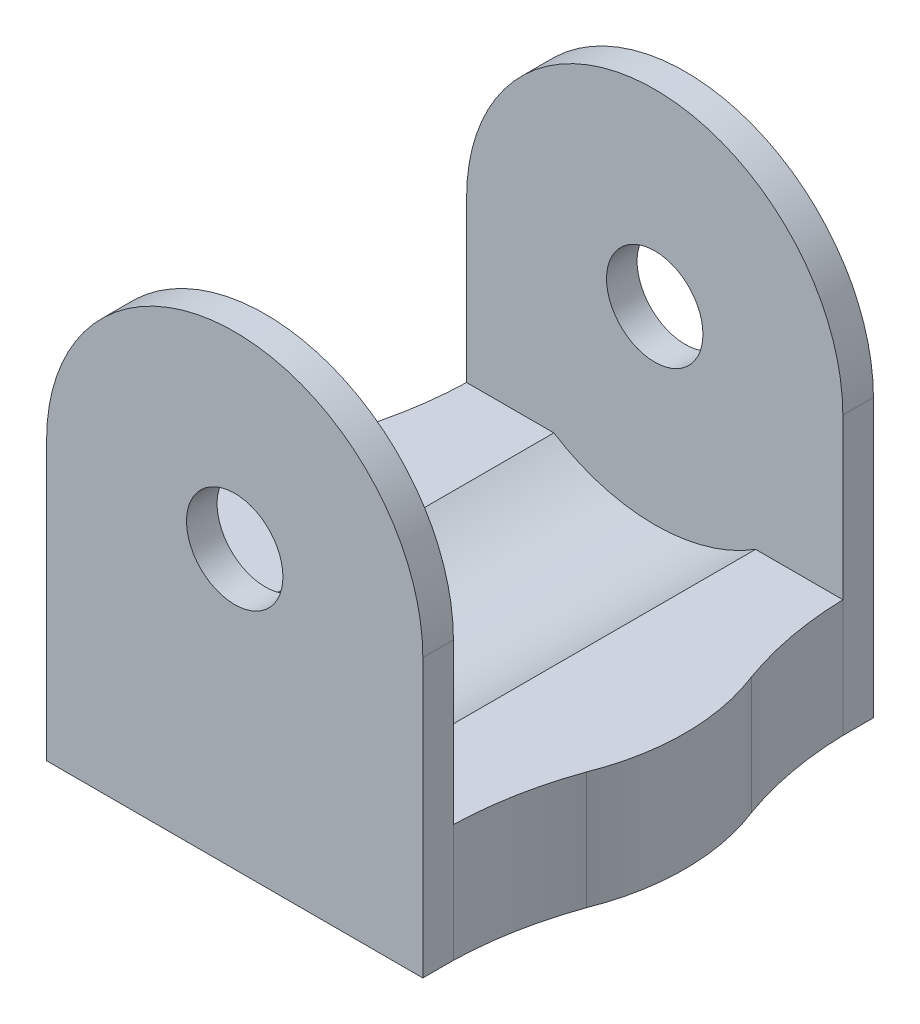
from build123d import *

# Parameters (mm, degrees)
SKETCH1_R                  = 47.8
SKETCH1_R_2                = 41.5
CAP_BASE_DEPTH             = 15
SKETCH2_R                  = 47.8
CAP_TOP_DEPTH              = 10
SIDES_START                = 41.4
SIDES_DEPTH                = 6.5
SIDES_START_2              = -25
SIDES_TO_CAP_DEPTH         = 25
SKETCH5_R                  = 40.2
TRACKS_FOR_HOUSING_DEPTH   = 45
SKETCH6_R                  = 10.25
HOLE_FOR_GEAR_SHAFTS_DEPTH = 146.82002606


with BuildPart() as part:
    # Sketch1 → Cap base (new body)
    with BuildSketch(Plane(origin=(0, 0, 0), x_dir=(1, 0, 0), z_dir=(0, 1, 0))):
        with Locations(Location((0, 0, 0), (0, 0, 270))):
            Circle(SKETCH1_R)
        with Locations(Location((0, 0, 0), (0, 0, 270))):
            Circle(SKETCH1_R_2, mode=Mode.SUBTRACT)
    extrude(amount=CAP_BASE_DEPTH)

    # Sketch2 → Cap top (add)
    with BuildSketch(Plane(origin=(0, 15, 0), x_dir=(1, 0, 0), z_dir=(0, 1, 0))):
        with Locations(Location((0, 0, 0), (0, 0, 270))):
            Circle(SKETCH2_R)
    extrude(amount=CAP_TOP_DEPTH)

    # Sketch3 → Sides (add)
    with BuildSketch(Plane.XY.offset(SIDES_START)):
        with BuildLine():
            Line((-40, 59), (-40, 0))
            Line((-40, 0), (40, 0))
            Line((40, 0), (40, 59))
            ThreePointArc((40, 59), (0, 99), (-40, 59))
        make_face()
    sides = extrude(amount=SIDES_DEPTH)

    # Sketch4 → Sides to cap (add)
    with BuildSketch(Plane(origin=(0, 25, 0), x_dir=(1, 0, 0), z_dir=(0, 1, 0)).offset(SIDES_START_2)):
        with BuildLine():
            ThreePointArc((-23.893095237, -41.4), (-36.205132569, -31.209427673), (-44.469611721, -17.529792737))
            ThreePointArc((-44.469611721, -17.529792737), (-41.281194911, -29.286336098), (-40, -41.4))
            Line((-40, -41.4), (-23.893095237, -41.4))
        make_face()
        with BuildLine():
            Line((23.893095237, -41.4), (40, -41.4))
            ThreePointArc((40, -41.4), (41.281194911, -29.286336098), (44.469611721, -17.529792737))
            ThreePointArc((44.469611721, -17.529792737), (36.205132569, -31.209427673), (23.893095237, -41.4))
        make_face()
    sides_to_cap = extrude(amount=SIDES_TO_CAP_DEPTH)

    # Mirror1: Sides to cap across plane
    add(sides_to_cap.mirror(Plane.XY))

    # Mirror sides: Sides across plane
    add(sides.mirror(Plane.XY))

    # Sketch5 → Tracks for housing (cut)
    with BuildSketch(Plane(origin=(0, 0, 41.4), x_dir=(-1, 0, 0), z_dir=(0, 0, -1))):
        with Locations((0, 59)):
            Circle(SKETCH5_R)
    tracks_for_housing = extrude(amount=TRACKS_FOR_HOUSING_DEPTH, mode=Mode.SUBTRACT)

    # Mirror tracks: Tracks for housing across plane
    add(tracks_for_housing.mirror(Plane.XY), mode=Mode.SUBTRACT)

    # Sketch6 → Hole for gear shafts (cut, through all)
    with BuildSketch(Plane.XY.offset(47.9)):
        with Locations((0, 59)):
            Circle(SKETCH6_R)
    extrude(amount=-HOLE_FOR_GEAR_SHAFTS_DEPTH, mode=Mode.SUBTRACT)


solid = part.part
